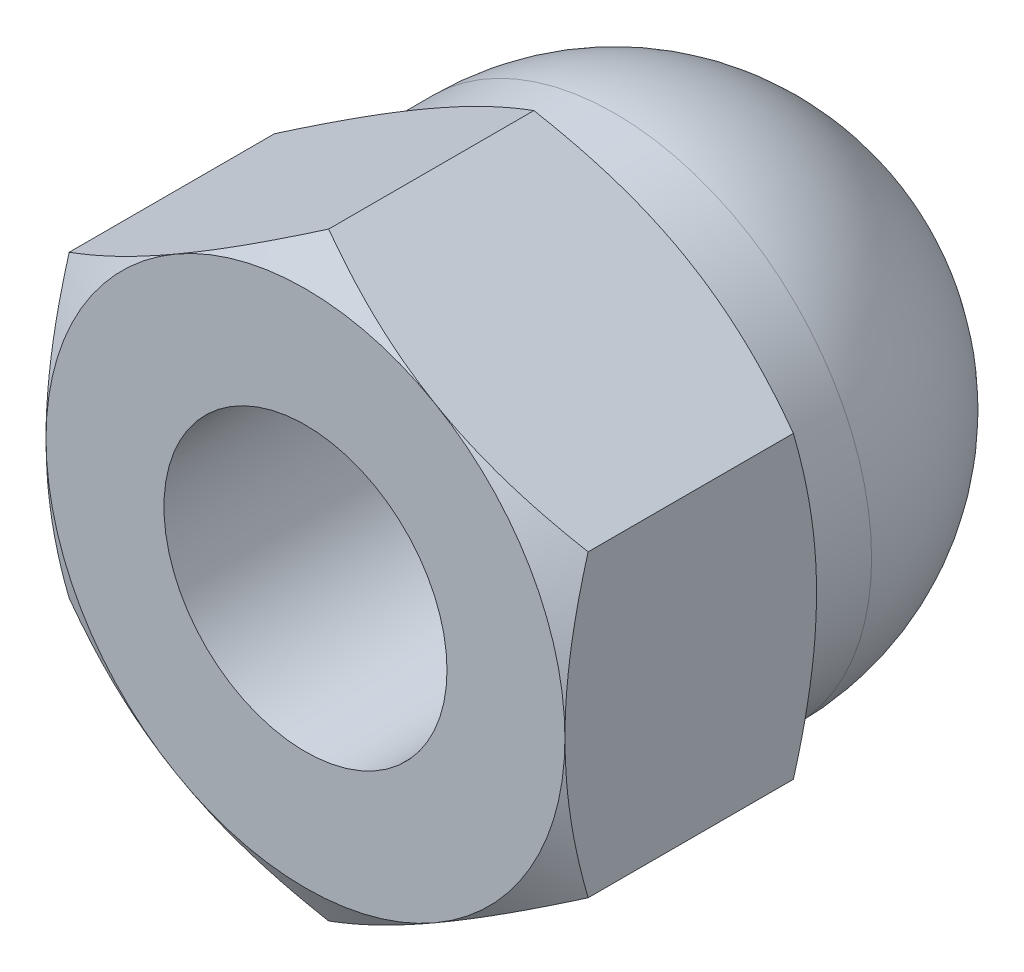
from build123d import *

# Parameters (mm, degrees)
EXTRUDE1_DEPTH     = 2.666666667
SKETCH2_OUTSIDE_W  = 29.964
SKETCH2_OUTSIDE_H  = 30.814
SKETCH2_OUTSIDE_R  = 2.75
CUT_EXTRUDE1_DEPTH = 5.97563508
CUT_EXTRUDE1_DRAFT = -60
SKETCH3_OUTSIDE_W  = 29.964
SKETCH3_OUTSIDE_H  = 30.814
SKETCH3_OUTSIDE_R  = 2.75
CUT_EXTRUDE2_DEPTH = 5.97563508
CUT_EXTRUDE2_DRAFT = -60
SKETCH4_R          = 1.5
CUT_EXTRUDE3_DEPTH = 3.8


with BuildPart() as part:
    # Sketch1 → Extrude1 (new body)
    with BuildSketch(Plane.XY):
        Polygon((0, 3.175426481), (-2.75, 1.58771324), (-2.75, -1.58771324), (0, -3.175426481), (2.75, -1.58771324), (2.75, 1.58771324), align=None)
    extrude(amount=-EXTRUDE1_DEPTH)


with BuildPart() as cut_extrude1_tool:
    # Sketch2 outside → Cut-Extrude1 (with draft: the straight prism first)
    with BuildSketch(Plane.XY):
        Rectangle(SKETCH2_OUTSIDE_W, SKETCH2_OUTSIDE_H)
        Circle(SKETCH2_OUTSIDE_R, mode=Mode.SUBTRACT)
    extrude(amount=-CUT_EXTRUDE1_DEPTH)
    # Cut-Extrude1: the draft: its side faces are tilted about the plane it starts from
    cut_extrude1_sides = [cut_extrude1_tool.faces().sort_by_distance(p)[0] for p in [
        (0, -15.407, -2.98781754),
        (14.982, 0, -2.98781754),
        (0, 15.407, -2.98781754),
        (-14.982, 0, -2.98781754),
        (-2.75, 0, -2.98781754),
    ]]
    draft(cut_extrude1_sides, Plane.XY, CUT_EXTRUDE1_DRAFT)


with BuildPart() as part_1:
    add(part.part)

    # Cut-Extrude1: cut by cut_extrude1_tool
    add(cut_extrude1_tool.part, mode=Mode.SUBTRACT)


with BuildPart() as cut_extrude2_tool:
    # Sketch3 outside → Cut-Extrude2 (with draft: the straight prism first)
    with BuildSketch(Plane(origin=(0, 0, -2.666666667), x_dir=(-1, 0, 0), z_dir=(0, 0, -1))):
        Rectangle(SKETCH3_OUTSIDE_W, SKETCH3_OUTSIDE_H)
        Circle(SKETCH3_OUTSIDE_R, mode=Mode.SUBTRACT)
    extrude(amount=-CUT_EXTRUDE2_DEPTH)
    # Cut-Extrude2: the draft: its side faces are tilted about the plane it starts from
    cut_extrude2_sides = [cut_extrude2_tool.faces().sort_by_distance(p)[0] for p in [
        (0, -15.407, 0.321150873),
        (-14.982, 0, 0.321150873),
        (0, 15.407, 0.321150873),
        (14.982, 0, 0.321150873),
        (2.75, 0, 0.321150873),
    ]]
    draft(cut_extrude2_sides, Plane(origin=(0, 0, -2.666666667), x_dir=(-1, 0, 0), z_dir=(0, 0, -1)), CUT_EXTRUDE2_DRAFT)


with BuildPart() as part_2:
    add(part_1.part)

    # Cut-Extrude2: cut by cut_extrude2_tool
    add(cut_extrude2_tool.part, mode=Mode.SUBTRACT)

    # Sketch14 → Revolve1 (revolve)
    with BuildSketch(Plane(origin=(0, 0, 0), x_dir=(0, 0, -1), z_dir=(1, 0, 0)), mode=Mode.PRIVATE) as revolve1_sk:
        with BuildLine():
            Line((2.666666667, 2.7225), (2.666666667, 0))
            Line((2.666666667, 0), (6, 0))
            ThreePointArc((6, 0), (5.202598212, 1.925098212), (3.2775, 2.7225))
            Line((3.2775, 2.7225), (2.666666667, 2.7225))
        make_face()
    revolve(revolve1_sk.sketch.rotate(Axis((0, 0, 0), (0, 0, -1)), 90), axis=Axis((0, 0, 0), (0, 0, -1)))

    # Sketch4 → Cut-Extrude3 (cut)
    with BuildSketch(Plane.XY):
        Circle(SKETCH4_R)
    extrude(amount=-CUT_EXTRUDE3_DEPTH, mode=Mode.SUBTRACT)


solid = part_2.part
